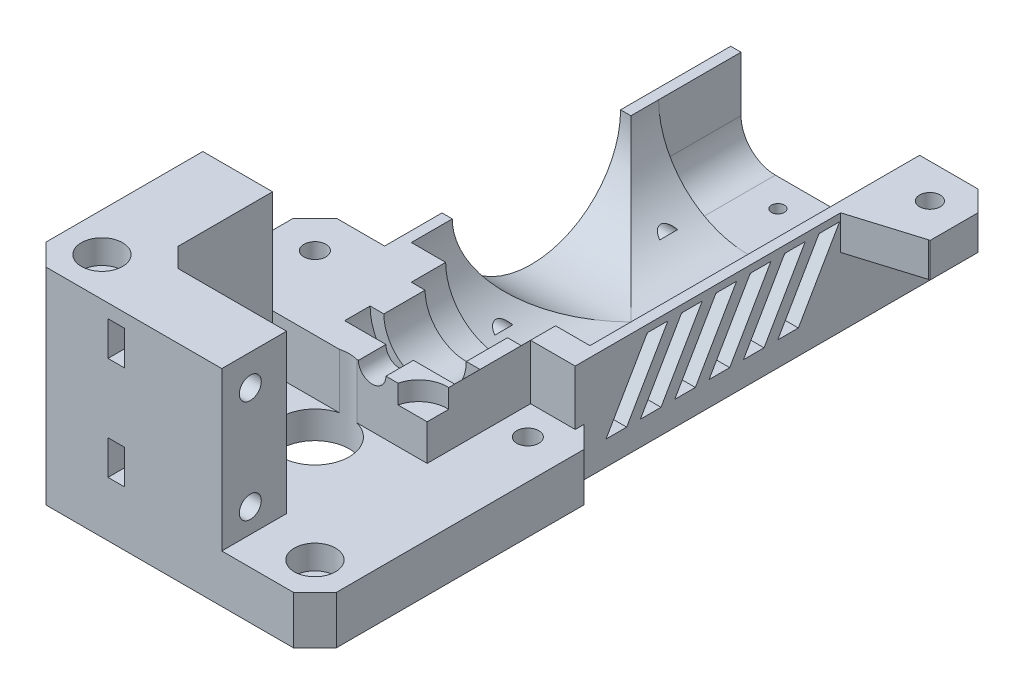
from build123d import *

# Parameters (mm, degrees)
P_IDAT_VYSUNUT_M1_DEPTH        = 6
P_IDAT_START                   = 5
P_IDAT_VYSUNUT_M2_DEPTH        = 5
P_IDAT_START_2                 = -47
P_IDAT_VYSUNUT_M3_DEPTH        = 47
P_IDAT_VYSUNUT_M4_DEPTH        = 12
ODEBRAT_START                  = 1
SKICA5_R                       = 2.5
ODEBRAT_VYSUNUT_M1_DEPTH       = 3
SKICA6_R                       = 0.935706623
ODEBRAT_VYSUNUT_M2_DEPTH       = 2
SKICA7_R                       = 1.6
SKICA7_R_2                     = 5
P_IDAT_VYSUNUT_M5_DEPTH        = 7
SKICA8_R                       = 1.6
ODEBRAT_VYSUNUT_M3_DEPTH       = 15
SKICA9_R                       = 1.6
P_IDAT_VYSUNUT_M6_DEPTH        = 8
SKICA10_R                      = 12.663125286
ODEBRAT_VYSUNUT_M4_DEPTH       = 3
P_IDAT_VYSUNUT_M7_DEPTH        = 3.7
P_IDAT_VYSUNUT_M8_DEPTH        = 4
ODEBRAT_START_2                = -8
SKICA14_R                      = 5
ODEBRAT_VYSUNUT_M5_DEPTH       = 8
SKICA15_R                      = 1.5
ODEBRAT_VYSUNUT_M6_DEPTH       = 8
ODEBRAT_VYSUNUT_M7_REACH       = 65.778
ODEBRAT_VYSUNUT_M7_END_RADIUS  = 13
SKICA16_R                      = 13
SKICA17_W                      = 6.496622643
SKICA17_H                      = 15.054857035
ODEBRAT_VYSUNUT_M8_DEPTH       = 8
ODEBRAT_START_3                = -2.75
ODEBRAT_VYSUNUT_M9_DEPTH       = 2.75
SKICA19_R                      = 1.600269864
ODEBRAT_VYSUNUT_M10_DEPTH      = 20
SKICA22_W                      = 2.4
SKICA22_H                      = 5
ODEBRAT_VYSUNUT_M11_DEPTH      = 8
SKICA23_R                      = 1.6
P_IDAT_VYSUNUT_M9_DEPTH        = 15
SKICA24_R                      = 3
ODEBRAT_VYSUNUT_M12_DEPTH      = 3.5
SKICA25_R                      = 1.600269864
ODEBRAT_VYSUNUT_M13_DEPTH      = 20
ODEBRAT_VYSUNUT_M14_REACH      = 99.077
SKICA27_W                      = 2.4
SKICA27_H                      = 5
SKICA29_R                      = 3
ODEBRAT_VYSUNUT_M15_DEPTH      = 3.5
ODEBRAT_VYSUNUT_M16_REACH      = 69.578
ODEBRAT_VYSUNUT_M16_END_RADIUS = 13
SKICA31_R                      = 1.5
P_IDAT_VYSUNUT_M10_DEPTH       = 5
ODEBRAT_VYSUNUT_M17_DEPTH      = 2.5


with BuildPart() as part:
    # Skica1 → Přidat vysunutím1 (new body)
    with BuildSketch(Plane.XY):
        with BuildLine():
            ThreePointArc((6, 0), (0, -6), (-6, 0))
            Line((-6, 0), (-13, 0))
            ThreePointArc((-13, 0), (0, -13), (13, 0))
            Line((13, 0), (6, 0))
        make_face()
    extrude(amount=P_IDAT_VYSUNUT_M1_DEPTH)

    # Skica2 → Přidat vysunutím2 (add)
    with BuildSketch(Plane(origin=(0, 0, 0), x_dir=(-1, 0, 0), z_dir=(0, 0, -1)).offset(P_IDAT_START)):
        with BuildLine():
            Line((13, 0), (8, 0))
            ThreePointArc((8, 0), (0, -8), (-8, 0))
            Line((-8, 0), (-13, 0))
            ThreePointArc((-13, 0), (0, -13), (13, 0))
        make_face()
    extrude(amount=-P_IDAT_VYSUNUT_M2_DEPTH)

    # Skica3 → Přidat vysunutím3 (add)
    with BuildSketch(Plane.XY.offset(6).offset(P_IDAT_START_2)):
        with BuildLine():
            Line((13, 0), (14.5, 0))
            Line((14.5, 0), (14.5, -15))
            Line((14.5, -15), (-14.5, -15))
            Line((-14.5, -15), (-14.5, 0))
            Line((-14.5, 0), (-13, 0))
            ThreePointArc((-13, 0), (0, -13), (13, 0))
        make_face()
    extrude(amount=P_IDAT_VYSUNUT_M3_DEPTH)

    # Skica4 → Přidat vysunutím4 (add)
    with BuildSketch(Plane(origin=(0, 0, -41), x_dir=(-1, 0, 0), z_dir=(0, 0, -1))):
        with BuildLine():
            Line((-14.5, 0), (-13, 0))
            Line((-13, 0), (-13, -8))
            ThreePointArc((-13, -8), (-11.535533906, -11.535533906), (-8, -13))
            Line((-8, -13), (8, -13))
            ThreePointArc((8, -13), (11.535533906, -11.535533906), (13, -8))
            Line((13, -8), (13, 0))
            Line((13, 0), (14.5, 0))
            Line((14.5, 0), (14.5, -15))
            Line((14.5, -15), (13, -15))
            Line((13, -15), (-13, -15))
            Line((-13, -15), (-14.5, -15))
            Line((-14.5, -15), (-14.5, 0))
        make_face()
    extrude(amount=P_IDAT_VYSUNUT_M4_DEPTH)

    # Skica5 → Odebrat vysunutím1 (cut)
    with BuildSketch(Plane(origin=(0, -13, 0), x_dir=(1, 0, 0), z_dir=(0, 1, 0)).offset(ODEBRAT_START)):
        with Locations(Location((7, 48.4, 0), (0, 0, 293.578178478))):
            Circle(SKICA5_R)
    extrude(amount=-ODEBRAT_VYSUNUT_M1_DEPTH, mode=Mode.SUBTRACT)

    # Skica6 → Odebrat vysunutím2 (cut)
    with BuildSketch(Plane.XZ.offset(15)):
        with Locations(Location((-3.569098922, -48.942253985, 0), (0, 0, 270))):
            Circle(SKICA6_R)
    extrude(amount=-ODEBRAT_VYSUNUT_M2_DEPTH, mode=Mode.SUBTRACT)

    # Skica7 → Přidat vysunutím5 (add)
    # profile 1 of 2: a face of its own
    with BuildSketch(Plane.XZ.offset(15)):
        with Locations((12, 3.039429741)):
            Circle(SKICA7_R)
    # profile 2 of 2: a face of its own
    with BuildSketch(Plane.XZ.offset(15)):
        Polygon((14.5, -2.610570259), (17.65, 0.539429741), (17.65, 36.542804565), (14.503374824, 39.689429741), (-21.496625176, 39.689429741), (-24.65, 36.536054918), (-24.65, 0.536054918), (-21.503374824, -2.610570259), (-14.5, -2.610570259), (-14.5, 6), (14.5, 6), align=None)
        with Locations(Location((-3.5, 18.539429741, 0), (0, 0, 270))):
            Circle(SKICA7_R_2, mode=Mode.SUBTRACT)
        with Locations(Location((-19, 3.039429741, 0), (0, 0, 270))):
            Circle(SKICA7_R, mode=Mode.SUBTRACT)
        with Locations(Location((-19, 34.039429741, 0), (0, 0, 270))):
            Circle(SKICA7_R, mode=Mode.SUBTRACT)
        with Locations(Location((12, 34.039429741, 0), (0, 0, 270))):
            Circle(SKICA7_R, mode=Mode.SUBTRACT)
    extrude(amount=-P_IDAT_VYSUNUT_M5_DEPTH)

    # Skica8 → Odebrat vysunutím3 (cut)
    with BuildSketch(Plane.XZ.offset(15)):
        with Locations(Location((12, 3.039429741, 0), (0, 0, 270))):
            Circle(SKICA8_R)
    extrude(amount=-ODEBRAT_VYSUNUT_M3_DEPTH, mode=Mode.SUBTRACT)

    # Skica9 → Přidat vysunutím6 (add)
    with BuildSketch(Plane(origin=(0, -8, 0), x_dir=(1, 0, 0), z_dir=(0, 1, 0))):
        Polygon((-14.5, -27.50379395), (-14.5, -6), (-14.5, 2.610570259), (-21.503374824, 2.610570259), (-24.65, -0.536054918), (-24.65, -36.536054918), (-21.496625176, -39.689429741), (4.095445139, -39.689429741), (4.095445139, -30.263717096), (-11.740076854, -30.263717096), align=None)
        with Locations(Location((-19, -34.039429741, 0), (0, 0, 90))):
            Circle(SKICA9_R, mode=Mode.SUBTRACT)
        with Locations(Location((-19, -3.039429741, 0), (0, 0, 90))):
            Circle(SKICA9_R, mode=Mode.SUBTRACT)
    extrude(amount=P_IDAT_VYSUNUT_M6_DEPTH)

    # Skica10 → Odebrat vysunutím4 (cut)
    with BuildSketch(Plane.XZ.offset(15)):
        with Locations(Location((-3.5, 18.539429741, 0), (0, 0, 270))):
            Circle(SKICA10_R)
    extrude(amount=-ODEBRAT_VYSUNUT_M4_DEPTH, mode=Mode.SUBTRACT)

    # Skica12 → Přidat vysunutím7 (add)
    with BuildSketch(Plane.XY.offset(6)):
        with BuildLine():
            ThreePointArc((8, 0), (5.656854249, -5.656854249), (0, -8))
            Line((0, -8), (14.5, -8))
            Line((14.5, -8), (14.5, 0))
            Line((14.5, 0), (8, 0))
        make_face()
        with BuildLine():
            Line((-14.5, 0), (-14.5, -8))
            Line((-14.5, -8), (0, -8))
            ThreePointArc((0, -8), (-5.656854249, -5.656854249), (-8, 0))
            Line((-8, 0), (-14.5, 0))
        make_face()
    extrude(amount=P_IDAT_VYSUNUT_M7_DEPTH)

    # Skica13 → Přidat vysunutím8 (add)
    with BuildSketch(Plane.XY.offset(9.7)):
        with BuildLine():
            Line((14.5, 0), (8, 0))
            ThreePointArc((8, 0), (5.656854249, -5.656854249), (0, -8))
            Line((0, -8), (14.5, -8))
            Line((14.5, -8), (14.5, 0))
        make_face()
        with BuildLine():
            ThreePointArc((2, 0), (0, -2), (-2, 0))
            Line((-2, 0), (-14.5, 0))
            Line((-14.5, 0), (-14.5, -8))
            Line((-14.5, -8), (0, -8))
            ThreePointArc((0, -8), (5.656854249, -5.656854249), (8, 0))
            Line((8, 0), (2, 0))
        make_face()
    extrude(amount=P_IDAT_VYSUNUT_M8_DEPTH)

    # Skica14 → Odebrat vysunutím5 (cut)
    with BuildSketch(Plane(origin=(0, 0, 0), x_dir=(1, 0, 0), z_dir=(0, 1, 0)).offset(ODEBRAT_START_2)):
        with Locations(Location((-3.5, -18.539429741, 0), (0, 0, 90))):
            Circle(SKICA14_R)
    extrude(amount=ODEBRAT_VYSUNUT_M5_DEPTH, mode=Mode.SUBTRACT)

    # Skica15 → Odebrat vysunutím6 (cut)
    with BuildSketch(Plane.ZY.offset(14.5)):
        with Locations((-11.965216354, -12)):
            Circle(SKICA15_R)
        with Locations((-35.965216354, -12)):
            Circle(SKICA15_R)
    extrude(amount=-ODEBRAT_VYSUNUT_M6_DEPTH, mode=Mode.SUBTRACT)

    # Odebrat vysunutím7: up to this cylinder (the profile starts outside it)
    odebrat_vysunut_m7_end = Plane(origin=(0, 0, -23.965216), z_dir=(0, 0, 1)) * Cylinder(ODEBRAT_VYSUNUT_M7_END_RADIUS, 158.556, mode=Mode.PRIVATE)
    # Skica16 → Odebrat vysunutím7 (cut, up to the surface)
    with BuildSketch(Plane.ZY.offset(14.5), mode=Mode.PRIVATE) as odebrat_vysunut_m7_sk1:
        with Locations((-23.965216354, 0)):
            Circle(SKICA16_R)
    odebrat_vysunut_m7_tool1 = extrude(odebrat_vysunut_m7_sk1.sketch, amount=-ODEBRAT_VYSUNUT_M7_REACH, mode=Mode.PRIVATE) - odebrat_vysunut_m7_end
    add(odebrat_vysunut_m7_tool1.solids().sort_by_distance((-14.5, 0, -23.965216))[0], mode=Mode.SUBTRACT)

    # Skica17 → Odebrat vysunutím8 (cut)
    with BuildSketch(Plane(origin=(0, 0, 0), x_dir=(1, 0, 0), z_dir=(0, 1, 0))):
        with Locations((11.251688679, -6.172571483)):
            Rectangle(SKICA17_W, SKICA17_H)
    extrude(amount=-ODEBRAT_VYSUNUT_M8_DEPTH, mode=Mode.SUBTRACT)

    # Skica18 → Odebrat vysunutím9 (cut)
    with BuildSketch(Plane(origin=(0, 0, 0), x_dir=(1, 0, 0), z_dir=(0, 1, 0)).offset(ODEBRAT_START_3)):
        with BuildLine():
            Line((3.762021029, -13.7), (8.003377357, -13.7))
            Line((8.003377357, -13.7), (8.003377357, -10.566864342))
            ThreePointArc((8.003377357, -10.566864342), (5.316782796, -11.367345619), (3.762021029, -13.7))
        make_face()
    extrude(amount=ODEBRAT_VYSUNUT_M9_DEPTH, mode=Mode.SUBTRACT)

    # Skica19 → Odebrat vysunutím10 (cut)
    with BuildSketch(Plane(origin=(4.095445139, 0, 0), x_dir=(0, 0, -1), z_dir=(1, 0, 0))):
        with Locations((-35.539431955, -4.499999892)):
            Circle(SKICA19_R)
    extrude(amount=-ODEBRAT_VYSUNUT_M10_DEPTH, mode=Mode.SUBTRACT)

    # Skica22 → Odebrat vysunutím11 (cut)
    with BuildSketch(Plane.XY.offset(39.689429741)):
        with Locations((-11.270059037, -4.499999892)):
            Rectangle(SKICA22_W, SKICA22_H)
    extrude(amount=-ODEBRAT_VYSUNUT_M11_DEPTH, mode=Mode.SUBTRACT)

    # Skica23 → Přidat vysunutím9 (add)
    with BuildSketch(Plane(origin=(0, 0, 0), x_dir=(1, 0, 0), z_dir=(0, 1, 0))):
        Polygon((-14.5, -27.50379395), (-14.5, -13.7), (-24.65, -13.7), (-24.65, -36.536054918), (-21.496625176, -39.689429741), (4.095445139, -39.689429741), (4.095445139, -30.263717096), (-11.740076854, -30.263717096), align=None)
        with Locations(Location((-19, -34.039429741, 0), (0, 0, 90))):
            Circle(SKICA23_R, mode=Mode.SUBTRACT)
    extrude(amount=P_IDAT_VYSUNUT_M9_DEPTH)

    # Skica24 → Odebrat vysunutím12 (cut)
    with BuildSketch(Plane(origin=(0, -8, 0), x_dir=(1, 0, 0), z_dir=(0, 1, 0))):
        with Locations(Location((12, -34.039429741, 0), (0, 0, 270))):
            Circle(SKICA24_R)
    extrude(amount=-ODEBRAT_VYSUNUT_M12_DEPTH, mode=Mode.SUBTRACT)

    # Skica25 → Odebrat vysunutím13 (cut)
    with BuildSketch(Plane(origin=(4.095445139, 0, 0), x_dir=(0, 0, -1), z_dir=(1, 0, 0))):
        with Locations((-35.539431955, 10.500000238)):
            Circle(SKICA25_R)
    extrude(amount=-ODEBRAT_VYSUNUT_M13_DEPTH, mode=Mode.SUBTRACT)

    # Odebrat vysunutím14: up to this face of the body (flat: up to its plane)
    odebrat_vysunut_m14_end = Plane(part.part.faces().sort_by_distance((-11.270059037, -4.499999892, 31.689429741))[0])
    # Skica27 → Odebrat vysunutím14 (cut, up to the picked face)
    with BuildSketch(Plane.XY.offset(39.689429741), mode=Mode.PRIVATE) as odebrat_vysunut_m14_sk1:
        with Locations((-11.270339088, 10.500000238)):
            Rectangle(SKICA27_W, SKICA27_H)
    odebrat_vysunut_m14_tool1 = split(extrude(odebrat_vysunut_m14_sk1.sketch, amount=-ODEBRAT_VYSUNUT_M14_REACH, mode=Mode.PRIVATE), bisect_by=odebrat_vysunut_m14_end, keep=Keep.BOTH, mode=Mode.PRIVATE)
    add(odebrat_vysunut_m14_tool1.solids().sort_by(Axis((-11.270339, 10.5, 39.68943), (0, 0, -1)))[0], mode=Mode.SUBTRACT)

    # Skica29 → Odebrat vysunutím15 (cut)
    with BuildSketch(Plane(origin=(0, 15, 0), x_dir=(1, 0, 0), z_dir=(0, 1, 0))):
        with Locations(Location((-19, -34.039429741, 0), (0, 0, 270))):
            Circle(SKICA29_R)
    extrude(amount=-ODEBRAT_VYSUNUT_M15_DEPTH, mode=Mode.SUBTRACT)

    # Odebrat vysunutím16: up to this cylinder (the profile starts outside it)
    odebrat_vysunut_m16_end = Plane(origin=(0, 0, -22.848748), z_dir=(0, 0, 1)) * Cylinder(ODEBRAT_VYSUNUT_M16_END_RADIUS, 191.156, mode=Mode.PRIVATE)
    # Skica30 → Odebrat vysunutím16 (cut, up to the surface)
    with BuildSketch(Plane(origin=(14.5, 0, 0), x_dir=(0, 0, -1), z_dir=(1, 0, 0)), mode=Mode.PRIVATE) as odebrat_vysunut_m16_sk1:
        Polygon((11.848748302, -1.057121507), (14.848748302, -1.057121507), (8.848748302, -11.449426353), (5.848748302, -11.449426353), align=None)
    odebrat_vysunut_m16_tool1 = extrude(odebrat_vysunut_m16_sk1.sketch, amount=-ODEBRAT_VYSUNUT_M16_REACH, mode=Mode.PRIVATE) - odebrat_vysunut_m16_end
    add(odebrat_vysunut_m16_tool1.solids().sort_by_distance((14.5, -6.253274, -10.348748))[0], mode=Mode.SUBTRACT)
    # Skica30 → Odebrat vysunutím16 (cut, up to the surface)
    with BuildSketch(Plane(origin=(14.5, 0, 0), x_dir=(0, 0, -1), z_dir=(1, 0, 0)), mode=Mode.PRIVATE) as odebrat_vysunut_m16_sk2:
        Polygon((16.848748302, -1.057121507), (19.848748302, -1.057121507), (13.848748302, -11.449426353), (10.848748302, -11.449426353), align=None)
    odebrat_vysunut_m16_tool2 = extrude(odebrat_vysunut_m16_sk2.sketch, amount=-ODEBRAT_VYSUNUT_M16_REACH, mode=Mode.PRIVATE) - odebrat_vysunut_m16_end
    add(odebrat_vysunut_m16_tool2.solids().sort_by_distance((14.5, -6.253274, -15.348748))[0], mode=Mode.SUBTRACT)
    # Skica30 → Odebrat vysunutím16 (cut, up to the surface)
    with BuildSketch(Plane(origin=(14.5, 0, 0), x_dir=(0, 0, -1), z_dir=(1, 0, 0)), mode=Mode.PRIVATE) as odebrat_vysunut_m16_sk3:
        Polygon((21.848748302, -1.057121507), (24.848748302, -1.057121507), (18.848748302, -11.449426353), (15.848748302, -11.449426353), align=None)
    odebrat_vysunut_m16_tool3 = extrude(odebrat_vysunut_m16_sk3.sketch, amount=-ODEBRAT_VYSUNUT_M16_REACH, mode=Mode.PRIVATE) - odebrat_vysunut_m16_end
    add(odebrat_vysunut_m16_tool3.solids().sort_by_distance((14.5, -6.253274, -20.348748))[0], mode=Mode.SUBTRACT)
    # Skica30 → Odebrat vysunutím16 (cut, up to the surface)
    with BuildSketch(Plane(origin=(14.5, 0, 0), x_dir=(0, 0, -1), z_dir=(1, 0, 0)), mode=Mode.PRIVATE) as odebrat_vysunut_m16_sk4:
        Polygon((26.848748302, -1.057121507), (29.848748302, -1.057121507), (23.848748302, -11.449426353), (20.848748302, -11.449426353), align=None)
    odebrat_vysunut_m16_tool4 = extrude(odebrat_vysunut_m16_sk4.sketch, amount=-ODEBRAT_VYSUNUT_M16_REACH, mode=Mode.PRIVATE) - odebrat_vysunut_m16_end
    add(odebrat_vysunut_m16_tool4.solids().sort_by_distance((14.5, -6.253274, -25.348748))[0], mode=Mode.SUBTRACT)
    # Skica30 → Odebrat vysunutím16 (cut, up to the surface)
    with BuildSketch(Plane(origin=(14.5, 0, 0), x_dir=(0, 0, -1), z_dir=(1, 0, 0)), mode=Mode.PRIVATE) as odebrat_vysunut_m16_sk5:
        Polygon((31.848748302, -1.057121507), (34.848748302, -1.057121507), (28.848748302, -11.449426353), (25.848748302, -11.449426353), align=None)
    odebrat_vysunut_m16_tool5 = extrude(odebrat_vysunut_m16_sk5.sketch, amount=-ODEBRAT_VYSUNUT_M16_REACH, mode=Mode.PRIVATE) - odebrat_vysunut_m16_end
    add(odebrat_vysunut_m16_tool5.solids().sort_by_distance((14.5, -6.253274, -30.348748))[0], mode=Mode.SUBTRACT)
    # Skica30 → Odebrat vysunutím16 (cut, up to the surface)
    with BuildSketch(Plane(origin=(14.5, 0, 0), x_dir=(0, 0, -1), z_dir=(1, 0, 0)), mode=Mode.PRIVATE) as odebrat_vysunut_m16_sk6:
        Polygon((36.848748302, -1.057121507), (39.848748302, -1.057121507), (33.848748302, -11.449426353), (30.848748302, -11.449426353), align=None)
    odebrat_vysunut_m16_tool6 = extrude(odebrat_vysunut_m16_sk6.sketch, amount=-ODEBRAT_VYSUNUT_M16_REACH, mode=Mode.PRIVATE) - odebrat_vysunut_m16_end
    add(odebrat_vysunut_m16_tool6.solids().sort_by_distance((14.5, -6.253274, -35.348748))[0], mode=Mode.SUBTRACT)

    # Skica31 → Přidat vysunutím10 (add)
    with BuildSketch(Plane.XZ):
        Polygon((24.5, -43), (24.312557855, -43), (14.5, -40), (14.5, -53), (21.5, -53), (24.5, -50), align=None)
        with Locations(Location((19.5, -48, 0), (0, 0, 270))):
            Circle(SKICA31_R, mode=Mode.SUBTRACT)
    extrude(amount=P_IDAT_VYSUNUT_M10_DEPTH)

    # Skica32 → Odebrat vysunutím17 (cut)
    with BuildSketch(Plane.XZ.offset(5)):
        Polygon((19.5, -51.175426481), (22.25, -49.58771324), (22.25, -46.41228676), (19.5, -44.824573519), (16.75, -46.41228676), (16.75, -49.58771324), align=None)
    extrude(amount=-ODEBRAT_VYSUNUT_M17_DEPTH, mode=Mode.SUBTRACT)


solid = part.part
